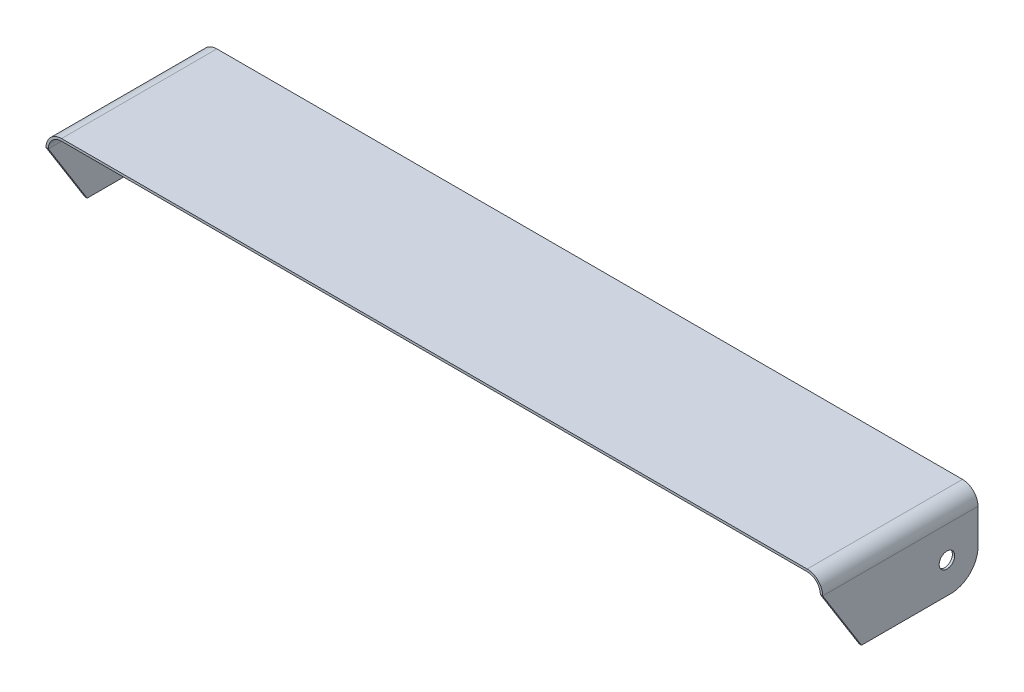
from build123d import *

# Parameters (mm, degrees)
BOSS_EXTRUDE1_DEPTH = 100
CUT_EXTRUDE1_DEPTH  = 1010.950493836
SKETCH3_R           = 10
CUT_EXTRUDE2_DEPTH  = 1010.950493836
FILLET1_R           = 35


with BuildPart() as part:
    # Sketch1 → Boss-Extrude1 (new, symmetric)
    with BuildSketch(Plane.XY):
        with BuildLine():
            Line((-500, 0), (-500, 80))
            ThreePointArc((-500, 80), (-494.142135624, 94.142135624), (-480, 100))
            Line((-480, 100), (480, 100))
            ThreePointArc((480, 100), (494.142135624, 94.142135624), (500, 80))
            Line((500, 80), (500, 0))
            Line((500, 0), (497, 0))
            Line((497, 0), (497, 80))
            ThreePointArc((497, 80), (492.02081528, 92.02081528), (480, 97))
            Line((480, 97), (-480, 97))
            ThreePointArc((-480, 97), (-492.02081528, 92.02081528), (-497, 80))
            Line((-497, 80), (-497, 0))
            Line((-497, 0), (-500, 0))
        make_face()
    extrude(amount=BOSS_EXTRUDE1_DEPTH, both=True)

    # Sketch2 → Cut-Extrude1 (cut, through all)
    with BuildSketch(Plane(origin=(500, 0, 0), x_dir=(0, 0, -1), z_dir=(1, 0, 0))):
        Polygon((-100, 80), (-100, 0), (-50, 0), align=None)
    extrude(amount=-CUT_EXTRUDE1_DEPTH, mode=Mode.SUBTRACT)

    # Sketch3 → Cut-Extrude2 (cut, through all)
    with BuildSketch(Plane(origin=(500, 0, 0), x_dir=(0, 0, -1), z_dir=(1, 0, 0))):
        with Locations((60, 40)):
            Circle(SKETCH3_R)
    extrude(amount=-CUT_EXTRUDE2_DEPTH, mode=Mode.SUBTRACT)

    # Fillet1
    fillet1_edges = [part.edges().sort_by_distance(p)[0] for p in [
        (498.5, 0, -100),
        (-498.5, 0, -100),
    ]]
    fillet(fillet1_edges, radius=FILLET1_R)


solid = part.part
